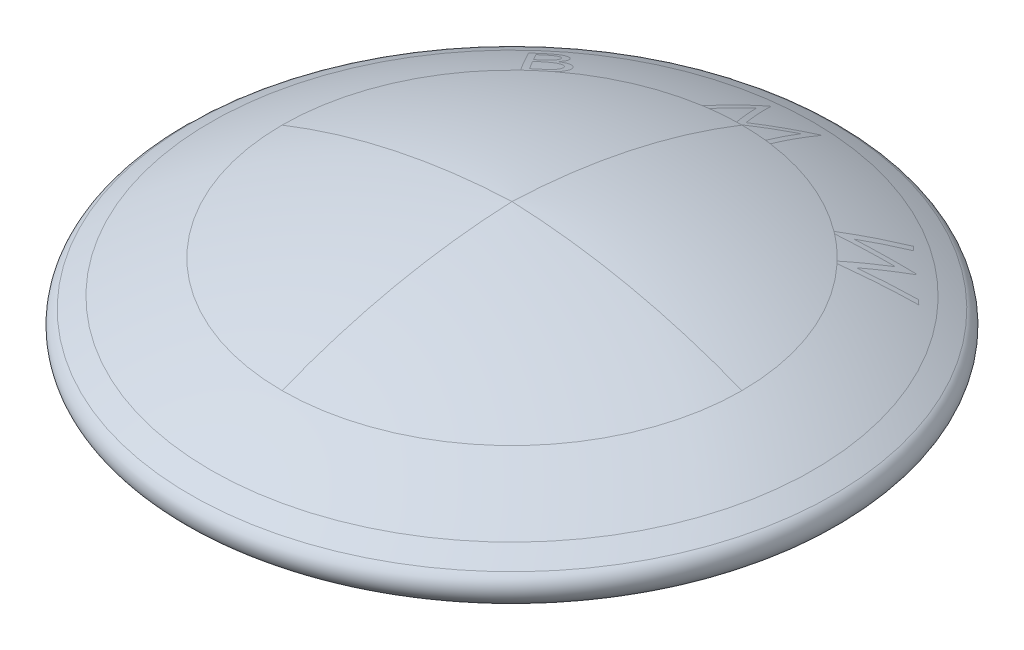
from build123d import *


with BuildPart() as part:
    # Sketch1 → Revolve1 (revolve)
    with BuildSketch(Plane(origin=(0, 0, 0), x_dir=(0, 0, -1), z_dir=(1, 0, 0))):
        with BuildLine():
            Line((0, 0), (5.023590882, 0))
            ThreePointArc((5.023590882, 0), (5.268911747, 0.188169357), (5.150753324, 0.473876587))
            ThreePointArc((5.150753324, 0.473876587), (2.666228464, 1.533690926), (0, 1.966468))
            Line((0, 1.966468), (0, 0))
        make_face()
    revolve(axis=Axis((0, -28.189540951, 0), (0, 1, 0)))


solid = part.part
